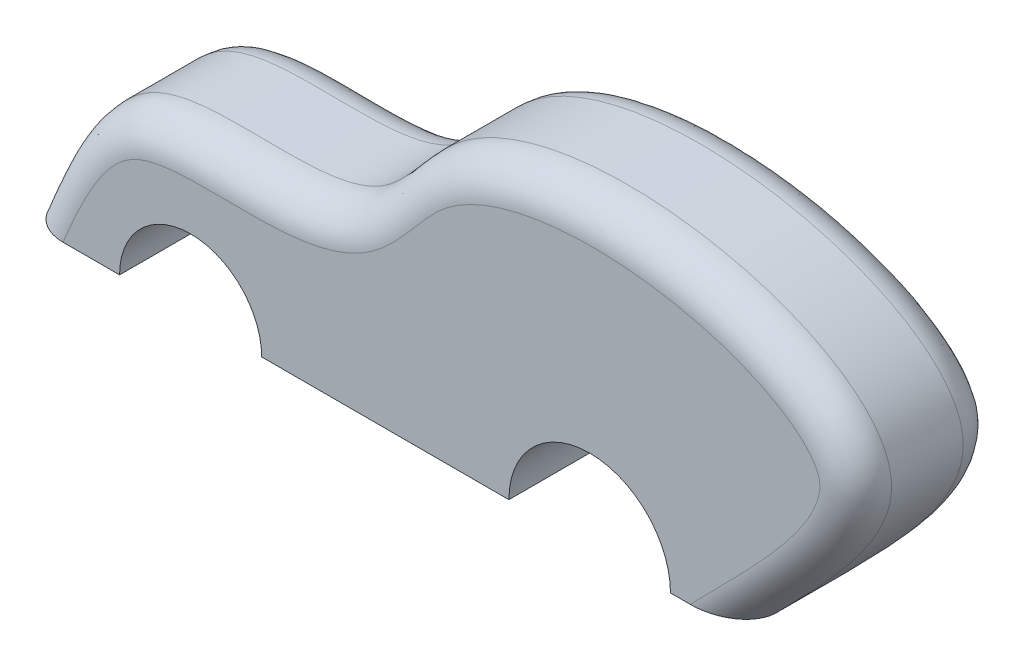
from build123d import *

# Parameters (mm, degrees)
BOSS_EXTRUDE1_DEPTH = 5.08
FILLET5_R           = 1.27
FILLET6_R           = 1.27


with BuildPart() as part:
    # Sketch1 → Boss-Extrude1 (new body)
    with BuildSketch(Plane.XY):
        with BuildLine():
            Line((-12.466748379, -5.173079569), (-9.084683162, -5.173079569))
            ThreePointArc((-9.084683162, -5.173079569), (-6.565389684, -2.653786091), (-4.046096205, -5.173079569))
            Line((-4.046096205, -5.173079569), (4.719664664, -5.173079569))
            ThreePointArc((4.719664664, -5.173079569), (7.584066838, -2.308677395), (10.448469012, -5.173079569))
            Line((10.448469012, -5.173079569), (12.933251621, -5.173079569))
            add(Edge.make_bspline(
                [(-12.466748379, -5.173079569), (-11.602609758, -3.088767253), (-9.565389759, 1.825030872), (-1.457469592, -0.974797564), (3.313594973, 7.662485597), (21.694466919, 3.734941187), (15.060531025, -3.010154856), (12.933251621, -5.173079569)],
                knots=[0, 0, 0, 0, 0.147100974, 0.346792793, 0.437561542, 0.819644964, 1, 1, 1, 1], degree=3))
        make_face()
    extrude(amount=BOSS_EXTRUDE1_DEPTH)

    # Fillet5
    fillet5_edges = [part.edges().sort_by_distance(p)[0] for p in [
        (4.701887828, 5.017984199, 5.08),
    ]]
    fillet(fillet5_edges, radius=FILLET5_R)

    # Fillet6
    fillet6_edges = [part.edges().sort_by_distance(p)[0] for p in [
        (4.701887828, 5.017984199, 0),
    ]]
    fillet(fillet6_edges, radius=FILLET6_R)


solid = part.part
